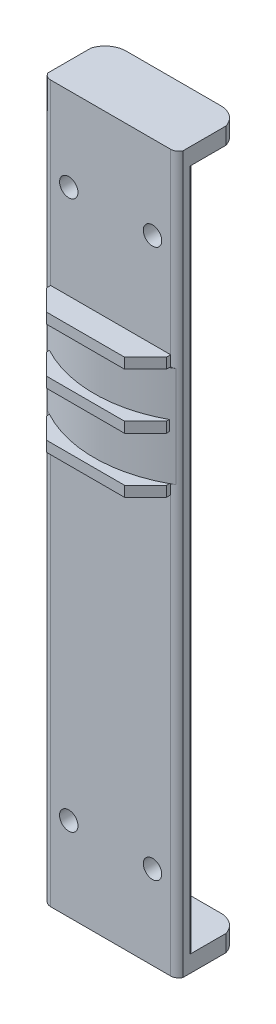
from build123d import *

# Parameters (mm, degrees)
BOSS_EXTRUDE1_DEPTH        = 163
FILLET1_R                  = 2
BOSS_EXTRUDE3_START        = 4
BOSS_EXTRUDE3_DEPTH        = 4
BOSS_EXTRUDE4_START        = -163
BOSS_EXTRUDE4_DEPTH        = 4
FILLET2_R                  = 5
BOSS_EXTRUDE5_START        = -126
BOSS_EXTRUDE5_DEPTH        = 24
SKETCH4_W                  = 28.635642126
SKETCH4_H                  = 6
BOSS_EXTRUDE6_DEPTH        = 2.5
BOSS_EXTRUDE7_START        = -24
SKETCH4_2_W                = 28.635642126
SKETCH4_2_H                = 6
BOSS_EXTRUDE7_DEPTH        = 2.5
BOSS_EXTRUDE8_DEPTH        = 1.25
BOSS_EXTRUDE8_DEPTH_BACK   = 1.25
BOSS_EXTRUDE8_START        = -12
SKETCH4_3_W                = 28.635642126
SKETCH4_3_H                = 6
CHAMFER1_SIZE              = 5
F_4_4_4_4_DIAMETER_HOLE1_D = 4.4
SKETCH7_W                  = 27.737228758
SKETCH7_H                  = 178.87682219
CUT_EXTRUDE1_DEPTH         = 0.2
CUT_EXTRUDE2_START         = -32.635642
SKETCH7_2_W                = 27.737228758
SKETCH7_2_H                = 178.87682219
CUT_EXTRUDE2_DEPTH         = 0.2


with BuildPart() as part:
    # Sketch1 → Boss-Extrude1 (new body)
    with BuildSketch(Plane(origin=(0, 0, 0), x_dir=(1, 0, 0), z_dir=(0, 1, 0))):
        with BuildLine():
            Line((-19.209372712, 16), (19.209372712, 16))
            ThreePointArc((19.209372712, 16), (0, 25), (-19.209372712, 16))
        make_face()
    extrude(amount=BOSS_EXTRUDE1_DEPTH)

    # Fillet1
    fillet1_edges = [part.edges().sort_by_distance(p)[0] for p in [
        (19.209372712, 81.5, -16),
        (-19.209372712, 81.5, -16),
    ]]
    fillet(fillet1_edges, radius=FILLET1_R)

    # Sketch2 → Boss-Extrude3 (add)
    with BuildSketch(Plane(origin=(0, 163, 0), x_dir=(1, 0, 0), z_dir=(0, 1, 0)).offset(BOSS_EXTRUDE3_START)):
        with BuildLine():
            Line((-16.317821063, 31), (-16.317821063, 18))
            ThreePointArc((-16.317821063, 18), (-15.732034626, 16.585786438), (-14.317821063, 16))
            Line((-14.317821063, 16), (14.317821063, 16))
            ThreePointArc((14.317821063, 16), (15.732034626, 16.585786438), (16.317821063, 18))
            Line((16.317821063, 18), (16.317821063, 31))
            Line((16.317821063, 31), (-16.317821063, 31))
        make_face()
    extrude(amount=-BOSS_EXTRUDE3_DEPTH)

    # Sketch2<2> → Boss-Extrude4 (add)
    with BuildSketch(Plane(origin=(0, 163, 0), x_dir=(1, 0, 0), z_dir=(0, 1, 0)).offset(BOSS_EXTRUDE4_START)):
        with BuildLine():
            Line((16.317821063, 31), (-16.317821063, 31))
            Line((-16.317821063, 31), (-16.317821063, 18))
            ThreePointArc((-16.317821063, 18), (-16.119217166, 18.868891294), (-15.562848982, 19.565217391))
            ThreePointArc((-15.562848982, 19.565217391), (0, 25), (15.562848982, 19.565217391))
            ThreePointArc((15.562848982, 19.565217391), (16.119217166, 18.868891294), (16.317821063, 18))
            Line((16.317821063, 18), (16.317821063, 31))
        make_face()
        with BuildLine():
            ThreePointArc((-15.562848982, 19.565217391), (-16.119217166, 18.868891294), (-16.317821063, 18))
            ThreePointArc((-16.317821063, 18), (-15.732034626, 16.585786438), (-14.317821063, 16))
            Line((-14.317821063, 16), (14.317821063, 16))
            ThreePointArc((14.317821063, 16), (15.732034626, 16.585786438), (16.317821063, 18))
            ThreePointArc((16.317821063, 18), (16.119217166, 18.868891294), (15.562848982, 19.565217391))
            ThreePointArc((15.562848982, 19.565217391), (0, 25), (-15.562848982, 19.565217391))
        make_face()
    extrude(amount=-BOSS_EXTRUDE4_DEPTH)

    # Fillet2
    fillet2_edges = [part.edges().sort_by_distance(p)[0] for p in [
        (16.317821063, 165, -31),
        (-16.317821063, 165, -31),
        (16.317821063, -2, -31),
        (-16.317821063, -2, -31),
    ]]
    fillet(fillet2_edges, radius=FILLET2_R)

    # Sketch3 → Boss-Extrude5 (add)
    with BuildSketch(Plane.XZ.offset(4).offset(BOSS_EXTRUDE5_START)):
        with BuildLine():
            ThreePointArc((15.340522568, -16.281255798), (0, -12.062418831), (-15.340522568, -16.281255798))
            ThreePointArc((-15.340522568, -16.281255798), (-14.848156615, -16.071595426), (-14.317821063, -16))
            Line((-14.317821063, -16), (14.317821063, -16))
            ThreePointArc((14.317821063, -16), (14.848156615, -16.071595426), (15.340522568, -16.281255798))
        make_face()
    extrude(amount=BOSS_EXTRUDE5_DEPTH)

    # Sketch4 → Boss-Extrude6 (add)
    with BuildSketch(Plane(origin=(0, 122, 0), x_dir=(1, 0, 0), z_dir=(0, 1, 0))):
        with Locations((0, 13)):
            Rectangle(SKETCH4_W, SKETCH4_H)
    extrude(amount=BOSS_EXTRUDE6_DEPTH)

    # Sketch4<2> → Boss-Extrude7 (add)
    with BuildSketch(Plane(origin=(0, 122, 0), x_dir=(1, 0, 0), z_dir=(0, 1, 0)).offset(BOSS_EXTRUDE7_START)):
        with Locations((0, 13)):
            Rectangle(SKETCH4_2_W, SKETCH4_2_H)
    extrude(amount=-BOSS_EXTRUDE7_DEPTH)

    # Sketch4<3> → Boss-Extrude8 (add, two sides: drawn at the far end of the back side and taken through both)
    with BuildSketch(Plane(origin=(0, 122, 0), x_dir=(1, 0, 0), z_dir=(0, 1, 0)).offset(BOSS_EXTRUDE8_START - BOSS_EXTRUDE8_DEPTH_BACK)):
        with Locations((0, 13)):
            Rectangle(SKETCH4_3_W, SKETCH4_3_H)
    extrude(amount=BOSS_EXTRUDE8_DEPTH + BOSS_EXTRUDE8_DEPTH_BACK)

    # Chamfer1
    chamfer1_edges = [part.edges().sort_by_distance(p)[0] for p in [
        (-14.317821063, 123.25, -10),
        (14.317821063, 123.25, -10),
        (14.317821063, 96.75, -10),
        (-14.317821063, 96.75, -10),
        (-14.317821063, 110, -10),
        (14.317821063, 110, -10),
    ]]
    chamfer(chamfer1_edges, length=CHAMFER1_SIZE)

    # Ø4.4 (4.4) Diameter Hole1 (through all)
    with Locations(Plane.XY.offset(-16)):
        with Locations((-10, 147), (10, 147), (10, 16), (-10, 16)):
            Hole(F_4_4_4_4_DIAMETER_HOLE1_D / 2)

    # Sketch7 → Cut-Extrude1 (cut)
    with BuildSketch(Plane.ZY.offset(16.317821063)):
        with Locations((-24.632131786, 79.951369179)):
            Rectangle(SKETCH7_W, SKETCH7_H)
    extrude(amount=-CUT_EXTRUDE1_DEPTH, mode=Mode.SUBTRACT)

    # Sketch7<2> → Cut-Extrude2 (cut)
    with BuildSketch(Plane.ZY.offset(16.317821063).offset(CUT_EXTRUDE2_START)):
        with Locations((-24.632131786, 79.951369179)):
            Rectangle(SKETCH7_2_W, SKETCH7_2_H)
    extrude(amount=CUT_EXTRUDE2_DEPTH, mode=Mode.SUBTRACT)


solid = part.part
